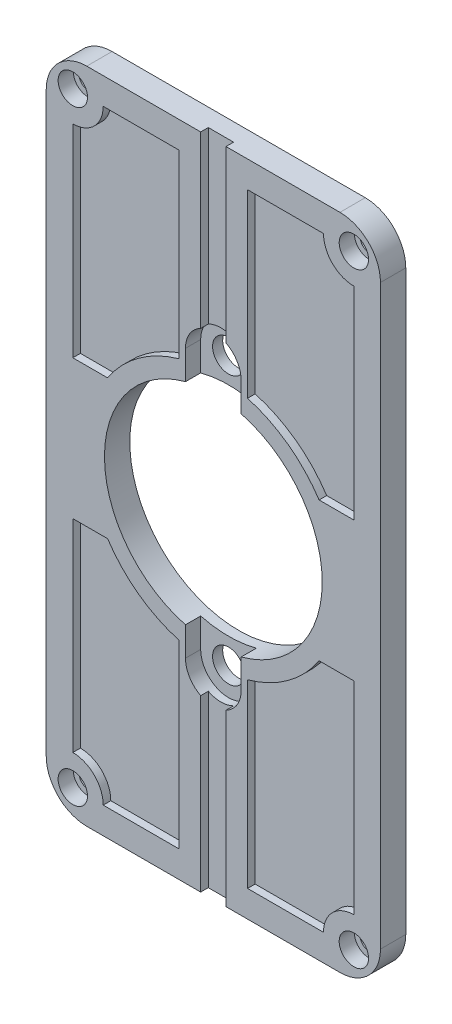
from build123d import *

# Parameters (mm, degrees)
BOSS_EXTRUDE1_DEPTH = 5
SKETCH2_R           = 21.5
CUT_EXTRUDE1_DEPTH  = 74.068461049
SKETCH3_R           = 3.15
CUT_EXTRUDE2_DEPTH  = 74.068461049
SKETCH12_R          = 2.9
CUT_EXTRUDE3_DEPTH  = 3
SKETCH13_R          = 1.75
CUT_EXTRUDE4_DEPTH  = 73.958892535
CUT_EXTRUDE5_DEPTH  = 3
CUT_EXTRUDE6_DEPTH  = 1.5


with BuildPart() as part:
    # Sketch1 → Boss-Extrude1 (new body)
    with BuildSketch(Plane.XY):
        with BuildLine():
            Line((25, 65), (-25, 65))
            ThreePointArc((-25, 65), (-30.656854249, 62.656854249), (-33, 57))
            Line((-33, 57), (-33, -57))
            ThreePointArc((-33, -57), (-30.656854249, -62.656854249), (-25, -65))
            Line((-25, -65), (25, -65))
            ThreePointArc((25, -65), (30.656854249, -62.656854249), (33, -57))
            Line((33, -57), (33, 57))
            ThreePointArc((33, 57), (30.656854249, 62.656854249), (25, 65))
        make_face()
    extrude(amount=BOSS_EXTRUDE1_DEPTH)

    # Sketch2 → Cut-Extrude1 (cut, through all)
    with BuildSketch(Plane.XY.offset(5)):
        Circle(SKETCH2_R)
    extrude(amount=-CUT_EXTRUDE1_DEPTH, mode=Mode.SUBTRACT)

    # Sketch3 → Cut-Extrude2 (cut, through all)
    with BuildSketch(Plane.XY.offset(5)):
        with Locations((0, 26.5)):
            Circle(SKETCH3_R)
        with Locations((0, -26.5)):
            Circle(SKETCH3_R)
    extrude(amount=-CUT_EXTRUDE2_DEPTH, mode=Mode.SUBTRACT)

    # Sketch12 → Cut-Extrude3 (cut)
    with BuildSketch(Plane.XY.offset(5)):
        with Locations((-27.75, 59.75)):
            Circle(SKETCH12_R)
        with Locations(Location((27.75, 59.75, 0), (0, 0, 180))):
            Circle(SKETCH12_R)
        with Locations(Location((-27.75, -59.75, 0), (0, 0, 180))):
            Circle(SKETCH12_R)
        with Locations((27.75, -59.75)):
            Circle(SKETCH12_R)
    extrude(amount=-CUT_EXTRUDE3_DEPTH, mode=Mode.SUBTRACT)

    # Sketch13 → Cut-Extrude4 (cut, through all)
    with BuildSketch(Plane.XY.offset(2)):
        with Locations((-27.75, 59.75)):
            Circle(SKETCH13_R)
        with Locations(Location((27.75, 59.75, 0), (0, 0, 180))):
            Circle(SKETCH13_R)
        with Locations((27.75, -59.75)):
            Circle(SKETCH13_R)
        with Locations(Location((-27.75, -59.75, 0), (0, 0, 180))):
            Circle(SKETCH13_R)
    extrude(amount=-CUT_EXTRUDE4_DEPTH, mode=Mode.SUBTRACT)

    # Sketch14 → Cut-Extrude5 (cut)
    with BuildSketch(Plane.XY.offset(5)):
        with BuildLine():
            Line((-5.5, 26.5), (-5.5, -26.5))
            ThreePointArc((-5.5, -26.5), (0, -32), (5.5, -26.5))
            Line((5.5, -26.5), (5.5, 26.5))
            ThreePointArc((5.5, 26.5), (0, 32), (-5.5, 26.5))
        make_face()
    extrude(amount=-CUT_EXTRUDE5_DEPTH, mode=Mode.SUBTRACT)

    # Sketch15 → Cut-Extrude6 (cut)
    with BuildSketch(Plane.XY.offset(5)):
        with BuildLine():
            Line((-2.5, 65), (-2.5, 31.398979486))
            ThreePointArc((-2.5, 31.398979486), (0, 32), (2.5, 31.398979486))
            Line((2.5, 31.398979486), (2.5, 65))
            Line((2.5, 65), (-2.5, 65))
        make_face()
        with BuildLine():
            Line((-27.75, 13.75), (-20.879116361, 13.75))
            ThreePointArc((-20.879116361, 13.75), (-14.747047157, 20.187238547), (-6.75, 24.071508054))
            Line((-6.75, 24.071508054), (-6.75, 59.75))
            Line((-6.75, 59.75), (-21.75, 59.75))
            ThreePointArc((-21.75, 59.75), (-23.507359313, 55.507359313), (-27.75, 53.75))
            Line((-27.75, 53.75), (-27.75, 13.75))
        make_face()
        with BuildLine():
            Line((27.75, 13.75), (20.879116361, 13.75))
            ThreePointArc((20.879116361, 13.75), (14.747047157, 20.187238547), (6.75, 24.071508054))
            Line((6.75, 24.071508054), (6.75, 59.75))
            Line((6.75, 59.75), (21.75, 59.75))
            ThreePointArc((21.75, 59.75), (23.507359313, 55.507359313), (27.75, 53.75))
            Line((27.75, 53.75), (27.75, 13.75))
        make_face()
        with BuildLine():
            Line((27.75, -53.75), (27.75, -13.75))
            Line((27.75, -13.75), (20.879116361, -13.75))
            ThreePointArc((20.879116361, -13.75), (14.747047157, -20.187238547), (6.75, -24.071508054))
            Line((6.75, -24.071508054), (6.75, -59.75))
            Line((6.75, -59.75), (21.75, -59.75))
            ThreePointArc((21.75, -59.75), (23.507359313, -55.507359313), (27.75, -53.75))
        make_face()
        with BuildLine():
            Line((2.5, -65), (2.5, -31.398979486))
            ThreePointArc((2.5, -31.398979486), (0, -32), (-2.5, -31.398979486))
            Line((-2.5, -31.398979486), (-2.5, -65))
            Line((-2.5, -65), (2.5, -65))
        make_face()
        with BuildLine():
            Line((-6.75, -59.75), (-6.75, -24.071508054))
            ThreePointArc((-6.75, -24.071508054), (-14.747047157, -20.187238547), (-20.879116361, -13.75))
            Line((-20.879116361, -13.75), (-27.75, -13.75))
            Line((-27.75, -13.75), (-27.75, -53.75))
            ThreePointArc((-27.75, -53.75), (-23.507359313, -55.507359313), (-21.75, -59.75))
            Line((-21.75, -59.75), (-6.75, -59.75))
        make_face()
    extrude(amount=-CUT_EXTRUDE6_DEPTH, mode=Mode.SUBTRACT)


solid = part.part
